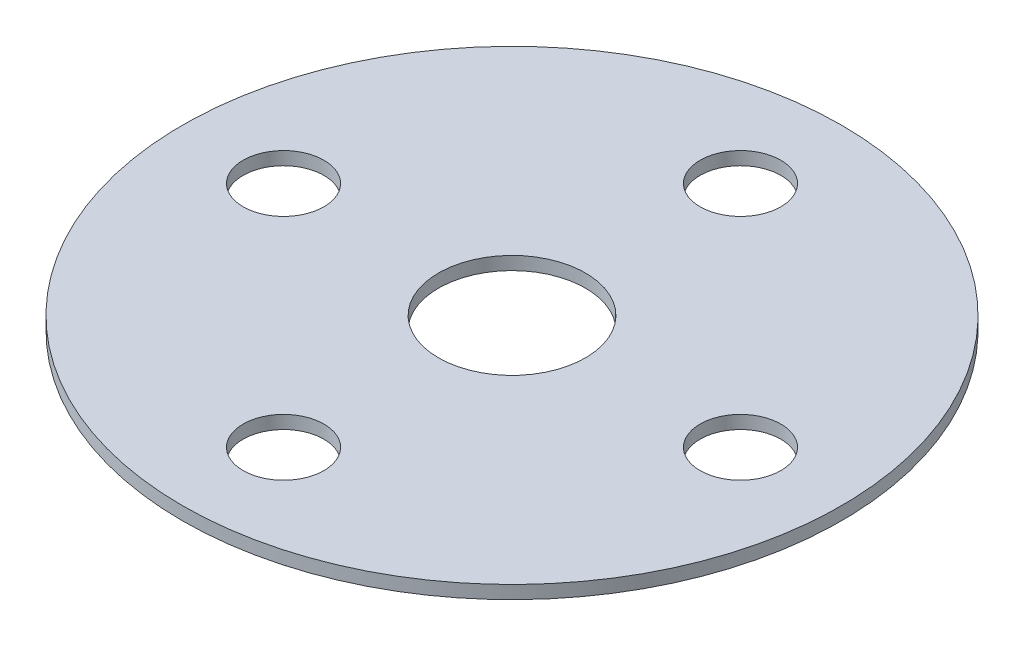
from build123d import *

# Parameters (mm, degrees)
SKETCH1_R           = 21.6364
SKETCH1_R_2         = 4.826
SKETCH1_R_3         = 2.65
BOSS_EXTRUDE1_DEPTH = 0.8636


with BuildPart() as part:
    # Sketch1 → Boss-Extrude1 (new body)
    with BuildSketch(Plane(origin=(0, 0, 0), x_dir=(1, 0, 0), z_dir=(0, 1, 0))):
        with Locations(Location((0, 0, 0), (0, 0, 270))):
            Circle(SKETCH1_R)
        with Locations(Location((0, 0, 0), (0, 0, 270))):
            Circle(SKETCH1_R_2, mode=Mode.SUBTRACT)
        with Locations(Location((0, 15, 0), (0, 0, 270))):
            Circle(SKETCH1_R_3, mode=Mode.SUBTRACT)
        with Locations(Location((15, 0, 0), (0, 0, 270))):
            Circle(SKETCH1_R_3, mode=Mode.SUBTRACT)
        with Locations(Location((0, -15, 0), (0, 0, 270))):
            Circle(SKETCH1_R_3, mode=Mode.SUBTRACT)
        with Locations(Location((-15, 0, 0), (0, 0, 270))):
            Circle(SKETCH1_R_3, mode=Mode.SUBTRACT)
    extrude(amount=BOSS_EXTRUDE1_DEPTH)


solid = part.part
